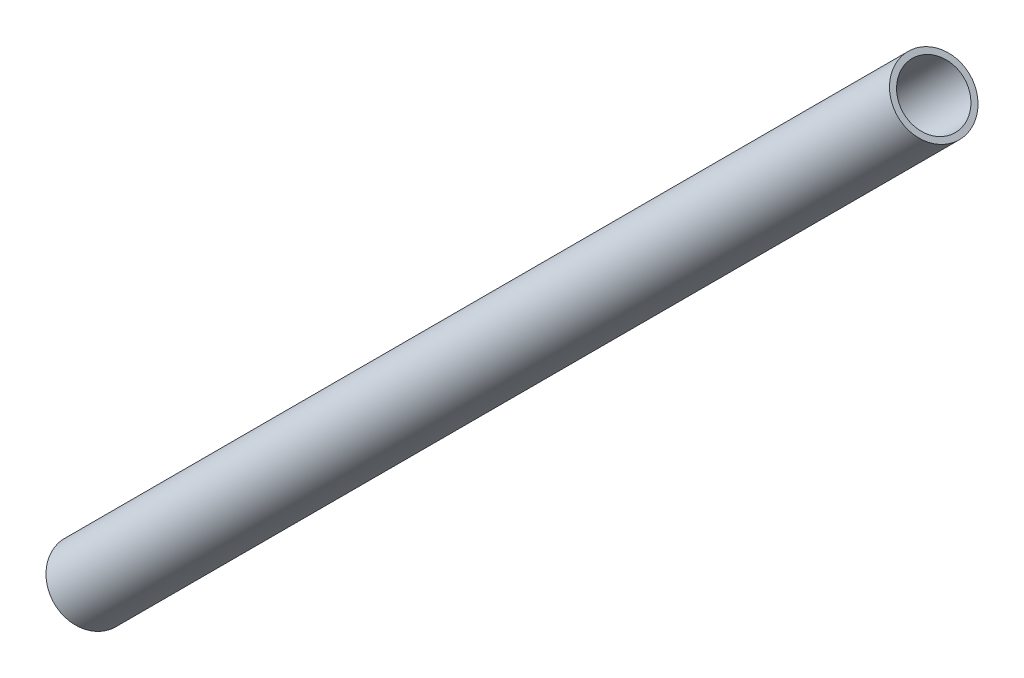
from build123d import *

# Parameters (mm, degrees)
SKETCH2_R           = 5
SKETCH2_R_2         = 4.2
BOSS_EXTRUDE1_DEPTH = 165


with BuildPart() as part:
    # Sketch2 → Boss-Extrude1 (new body)
    with BuildSketch(Plane(origin=(94.859307055, 94.859307055, 0), x_dir=(0, 0, 1), z_dir=(-0.707106781186544, -0.7071067811865511, 0))):
        with Locations(Location((-10, -38.456734122, 0), (0, 0, 270))):
            Circle(SKETCH2_R)
        with Locations(Location((-10, -38.456734122, 0), (0, 0, 270))):
            Circle(SKETCH2_R_2, mode=Mode.SUBTRACT)
    extrude(amount=BOSS_EXTRUDE1_DEPTH)


solid = part.part
